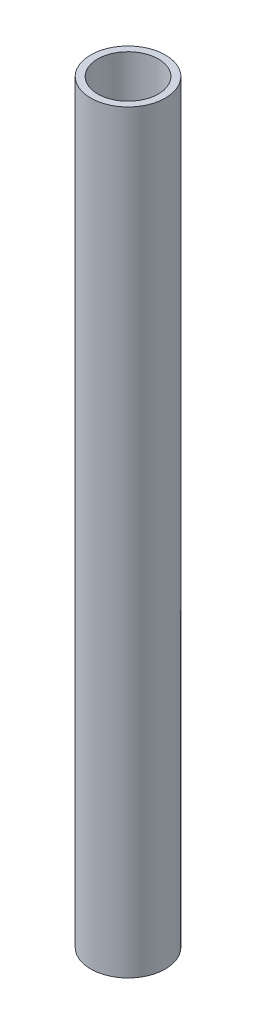
from build123d import *

# Parameters (mm, degrees)
SKETCH_1_R      = 10.65
SKETCH_1_R_2    = 8.65
EXTRUDE_1_DEPTH = 215


with BuildPart() as part:
    # Эскиз1 → Бобышка-Вытянуть1 (new body)
    with BuildSketch(Plane(origin=(0, 0, 0), x_dir=(1, 0, 0), z_dir=(0, 1, 0))):
        with Locations(Location((0, -1.5, 0), (0, 0, 90))):
            Circle(SKETCH_1_R)
        with Locations(Location((0, -1.5, 0), (0, 0, 90))):
            Circle(SKETCH_1_R_2, mode=Mode.SUBTRACT)
    extrude(amount=EXTRUDE_1_DEPTH)


solid = part.part
